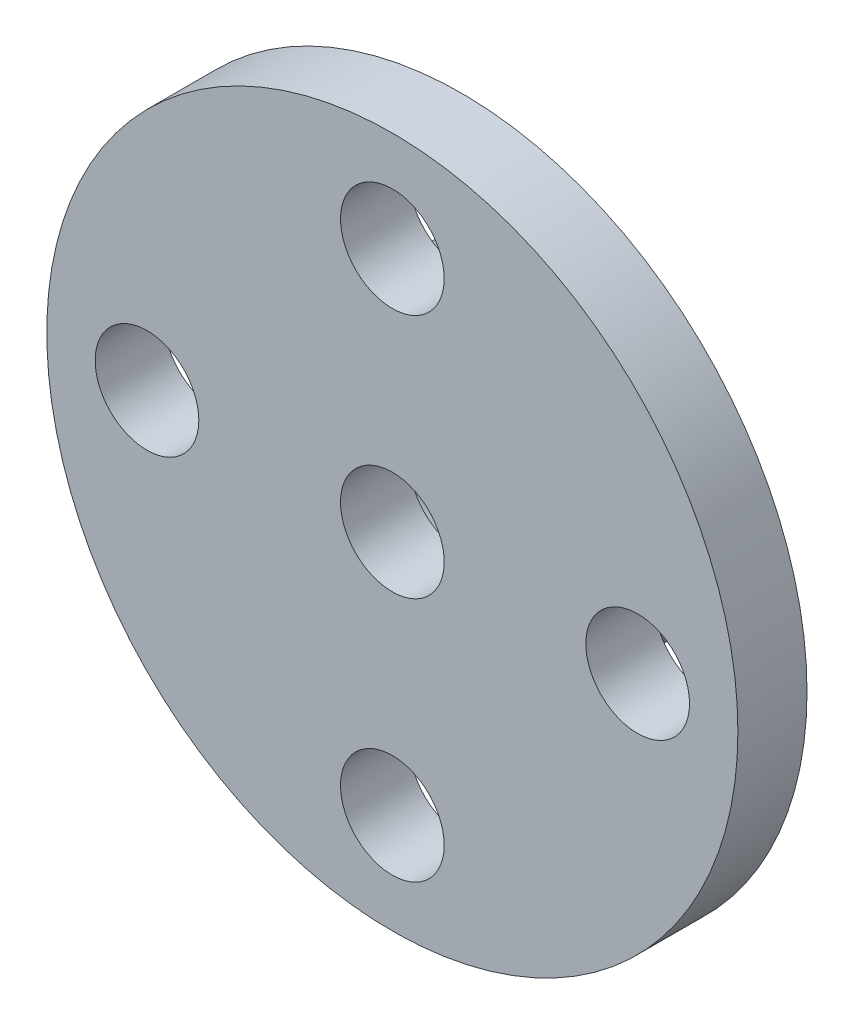
from build123d import *

# Parameters (mm, degrees)
SKETCH_1_R          = 10
EXTRUDE_1_DEPTH     = 2
CUT_EXTRUDE_1_REACH = 16.283
SKETCH_2_R          = 1.5
SKETCH_3_R          = 4.75
SKETCH_3_R_2        = 3
EXTRUDE_2_DEPTH     = 3.5


with BuildPart() as part:
    # 草图1 → 凸台-拉伸1 (new body)
    with BuildSketch(Plane.XY):
        Circle(SKETCH_1_R)
    extrude(amount=-EXTRUDE_1_DEPTH)

    # 草图2 → 切除-拉伸1 (cut, up to next)
    with BuildSketch(Plane.XY, mode=Mode.PRIVATE) as cut_extrude_1_sk1:
        Circle(SKETCH_2_R)
    cut_extrude_1_tool1 = extrude(cut_extrude_1_sk1.sketch, amount=-CUT_EXTRUDE_1_REACH, mode=Mode.PRIVATE) & part.part
    # 草图2 → 切除-拉伸1 (cut, up to next)
    with BuildSketch(Plane.XY, mode=Mode.PRIVATE) as cut_extrude_1_sk2:
        with Locations((-7.1, 0)):
            Circle(SKETCH_2_R)
    cut_extrude_1_tool2 = extrude(cut_extrude_1_sk2.sketch, amount=-CUT_EXTRUDE_1_REACH, mode=Mode.PRIVATE) & part.part
    # 草图2 → 切除-拉伸1 (cut, up to next)
    with BuildSketch(Plane.XY, mode=Mode.PRIVATE) as cut_extrude_1_sk3:
        with Locations((0, 7.1)):
            Circle(SKETCH_2_R)
    cut_extrude_1_tool3 = extrude(cut_extrude_1_sk3.sketch, amount=-CUT_EXTRUDE_1_REACH, mode=Mode.PRIVATE) & part.part
    # 草图2 → 切除-拉伸1 (cut, up to next)
    with BuildSketch(Plane.XY, mode=Mode.PRIVATE) as cut_extrude_1_sk4:
        with Locations((7.1, 0)):
            Circle(SKETCH_2_R)
    cut_extrude_1_tool4 = extrude(cut_extrude_1_sk4.sketch, amount=-CUT_EXTRUDE_1_REACH, mode=Mode.PRIVATE) & part.part
    # 草图2 → 切除-拉伸1 (cut, up to next)
    with BuildSketch(Plane.XY, mode=Mode.PRIVATE) as cut_extrude_1_sk5:
        with Locations((0, -7.1)):
            Circle(SKETCH_2_R)
    cut_extrude_1_tool5 = extrude(cut_extrude_1_sk5.sketch, amount=-CUT_EXTRUDE_1_REACH, mode=Mode.PRIVATE) & part.part
    add(cut_extrude_1_tool1.solids().sort_by_distance((0, 0, 0))[0], mode=Mode.SUBTRACT)
    add(cut_extrude_1_tool2.solids().sort_by_distance((-7.1, 0, 0))[0], mode=Mode.SUBTRACT)
    add(cut_extrude_1_tool3.solids().sort_by_distance((0, 7.1, 0))[0], mode=Mode.SUBTRACT)
    add(cut_extrude_1_tool4.solids().sort_by_distance((7.1, 0, 0))[0], mode=Mode.SUBTRACT)
    add(cut_extrude_1_tool5.solids().sort_by_distance((0, -7.1, 0))[0], mode=Mode.SUBTRACT)

    # 草图3 → 凸台-拉伸2 (add)
    with BuildSketch(Plane(origin=(0, 0, -2), x_dir=(-1, 0, 0), z_dir=(0, 0, -1))):
        with Locations(Location((0, 0, 0), (0, 0, 180))):
            Circle(SKETCH_3_R)
        Circle(SKETCH_3_R_2, mode=Mode.SUBTRACT)
    extrude(amount=EXTRUDE_2_DEPTH)


solid = part.part
